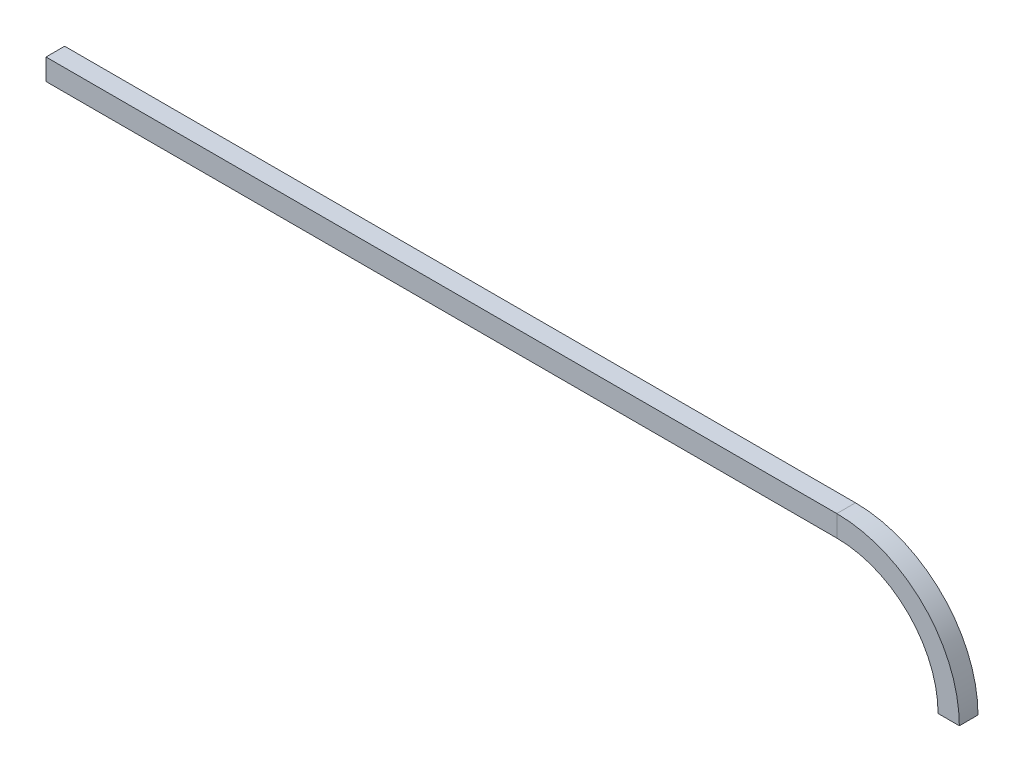
from build123d import *

# Parameters (mm, degrees)
SKETCH3_W          = 1.27
SKETCH3_H          = 1.4478
SKETCH9_W          = 0.635
SKETCH9_H          = 0.635
CUT_EXTRUDE1_DEPTH = 50.8


with BuildPart() as part:
    # Sweep2: sweep along a path in Sketch2
    with BuildLine(Plane.XY) as sweep2_path:
        Line((0, 0), (53.848, 0))
        ThreePointArc((53.848, 0), (59.236153673, -2.231846327), (61.468, -7.62))
    # Sketch3 → Sweep2 (sweep)
    with BuildSketch(Plane(origin=(0, 0, 0), x_dir=(0, 0, -1), z_dir=(1, 0, 0))):
        Rectangle(SKETCH3_W, SKETCH3_H)
    sweep(path=sweep2_path.line)

    # Sketch9 → Cut-Extrude1 (cut)
    with BuildSketch(Plane.ZY):
        Rectangle(SKETCH9_W, SKETCH9_H)
    extrude(amount=-CUT_EXTRUDE1_DEPTH, mode=Mode.SUBTRACT)


solid = part.part
